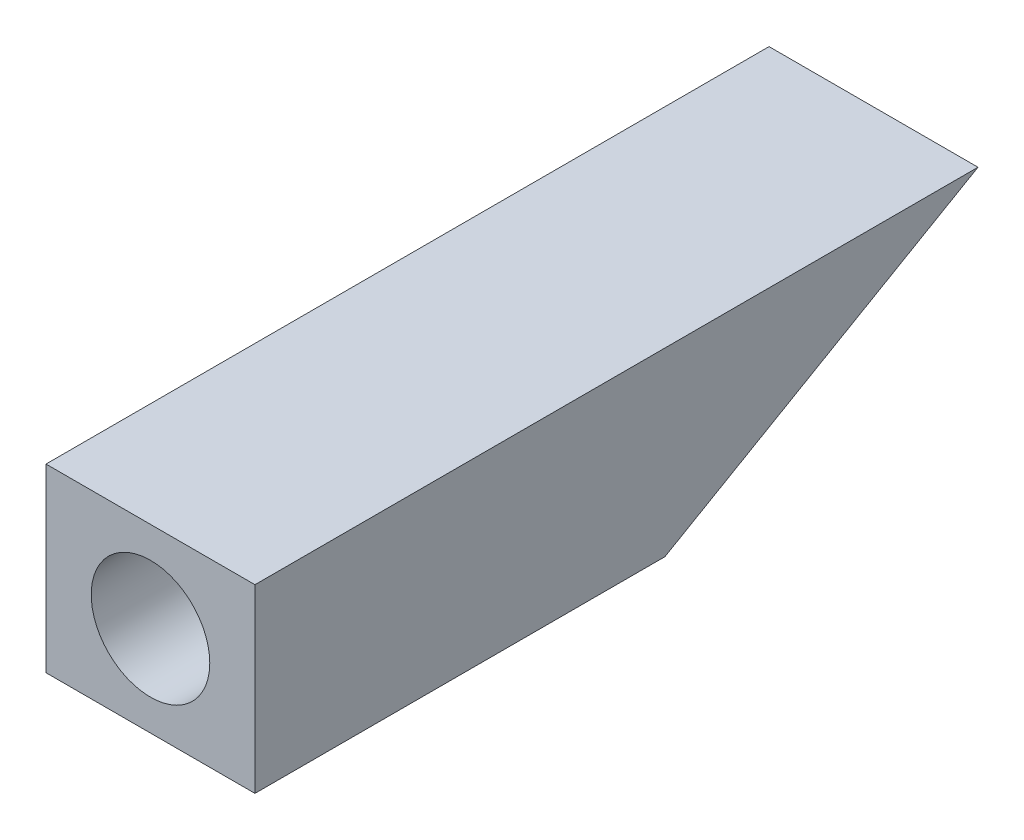
from build123d import *

# Parameters (mm, degrees)
SKETCH1_W           = 7.3406
SKETCH1_H           = 6.35
BOSS_EXTRUDE1_DEPTH = 25.4
CUT_EXTRUDE1_DEPTH  = 7.3406
SKETCH3_R           = 2.0828
CUT_EXTRUDE2_DEPTH  = 25.4


with BuildPart() as part:
    # Sketch1 → Boss-Extrude1 (new body)
    with BuildSketch(Plane.XY):
        Rectangle(SKETCH1_W, SKETCH1_H)
    extrude(amount=BOSS_EXTRUDE1_DEPTH)

    # Sketch2 → Cut-Extrude1 (cut)
    with BuildSketch(Plane(origin=(3.6703, 0, 0), x_dir=(0, 0, -1), z_dir=(1, 0, 0))):
        Polygon((0, 3.175), (-10.998522628, -3.175), (0, -3.175), align=None)
    extrude(amount=-CUT_EXTRUDE1_DEPTH, mode=Mode.SUBTRACT)

    # Sketch3 → Cut-Extrude2 (cut)
    with BuildSketch(Plane.XY.offset(25.4)):
        Circle(SKETCH3_R)
    extrude(amount=-CUT_EXTRUDE2_DEPTH, mode=Mode.SUBTRACT)


solid = part.part
